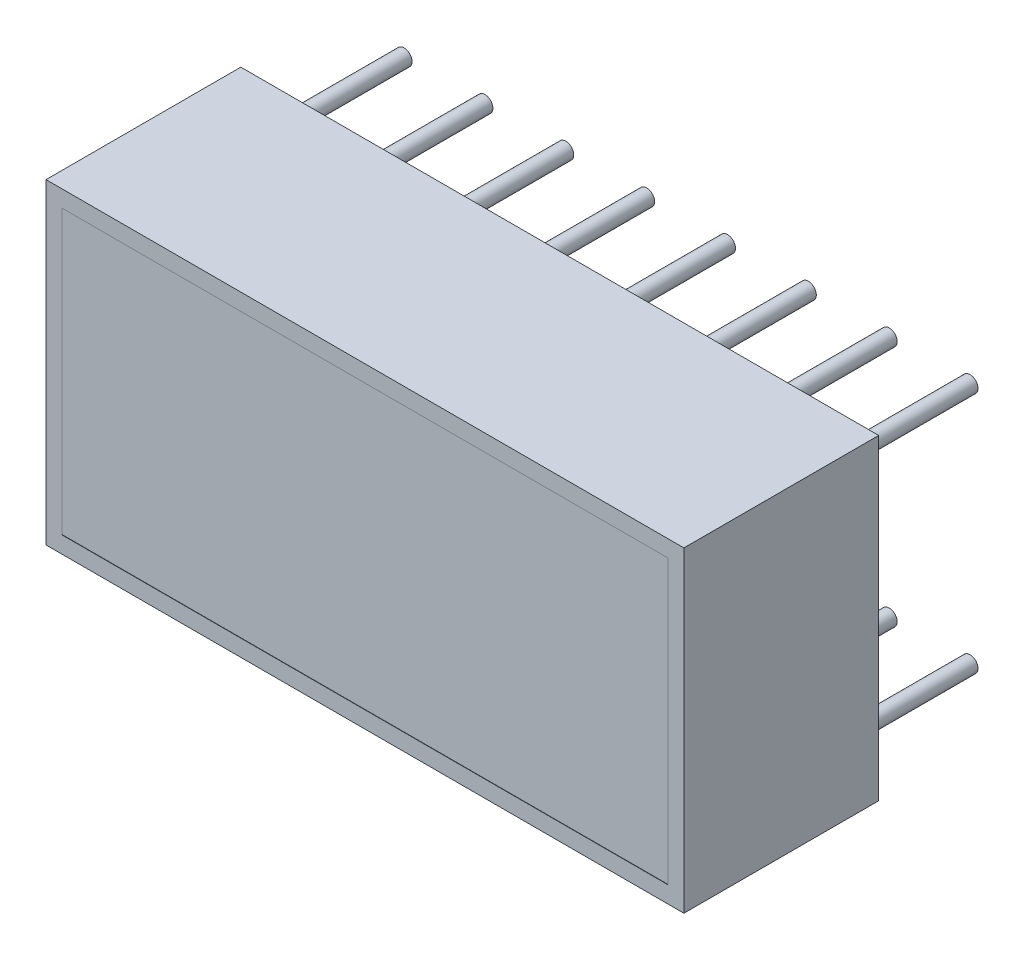
from build123d import *

# Parameters (mm, degrees)
SKETCH_1_W                  = 20.04
SKETCH_1_H                  = 9.94
EXTRUDE_1_DEPTH             = 6.12
SKETCH_2_R                  = 0.25
EXTRUDE_2_DEPTH             = 4
PATTERN_LINEAR_1_COUNT      = 8
PATTERN_LINEAR_1_PITCH      = 2.54
PATTERN_LINEAR_1_COUNT_DIR2 = 2
PATTERN_LINEAR_1_PITCH_DIR2 = 7.62
SKETCH_3_W                  = 19.05
SKETCH_3_H                  = 8.89
CUT_EXTRUDE_1_DEPTH         = 0.01


with BuildPart() as part:
    # Эскиз1 → Бобышка-Вытянуть1 (new body)
    with BuildSketch(Plane.XY):
        Rectangle(SKETCH_1_W, SKETCH_1_H)
    extrude(amount=EXTRUDE_1_DEPTH)

    # Эскиз2 → Бобышка-Вытянуть2 (add)
    with BuildSketch(Plane(origin=(0, 0, 0), x_dir=(-1, 0, 0), z_dir=(0, 0, -1))):
        with Locations((8.89, -3.81)):
            Circle(SKETCH_2_R)
    extrude_2 = extrude(amount=EXTRUDE_2_DEPTH)

    # Линейный массив1: Extrude 2 8 × 2
    with Locations(*[(i * PATTERN_LINEAR_1_PITCH, j * PATTERN_LINEAR_1_PITCH_DIR2, 0) for i in range(PATTERN_LINEAR_1_COUNT) for j in range(PATTERN_LINEAR_1_COUNT_DIR2) if (i, j) != (0, 0)]):
        add(extrude_2)

    # Эскиз3 → Вырез-Вытянуть1 (cut)
    with BuildSketch(Plane.XY.offset(6.12)):
        Rectangle(SKETCH_3_W, SKETCH_3_H)
    extrude(amount=-CUT_EXTRUDE_1_DEPTH, mode=Mode.SUBTRACT)


solid = part.part
